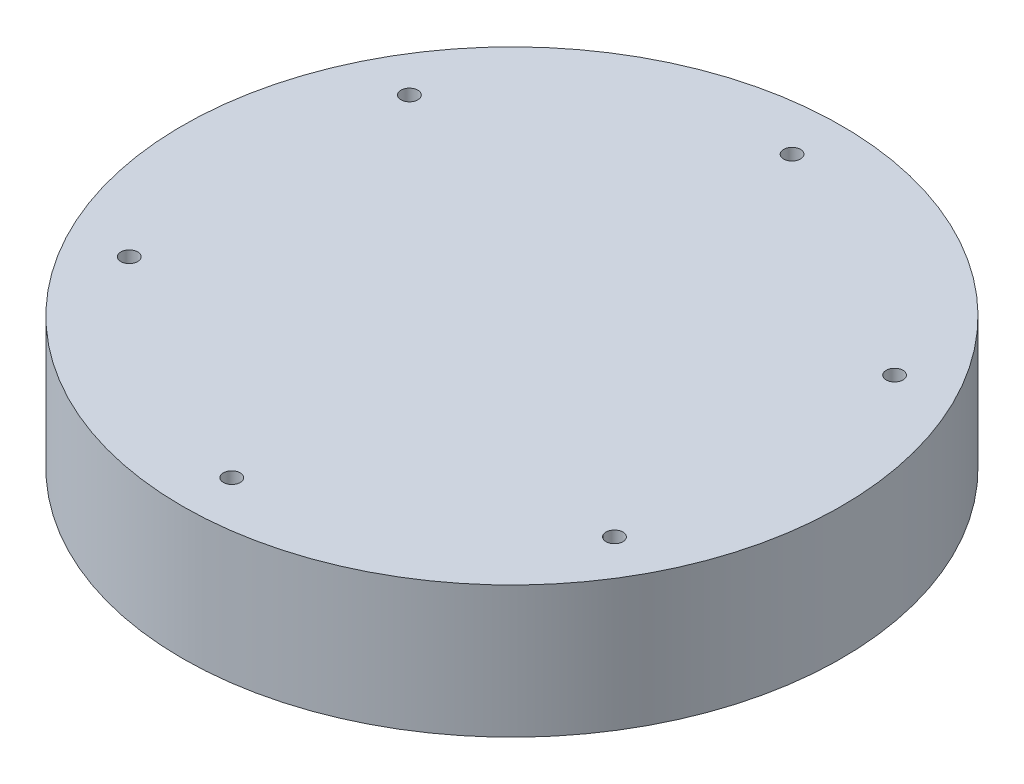
from build123d import *

# Parameters (mm, degrees)
SKETCH1_R           = 100
BOSS_EXTRUDE1_DEPTH = 40
CIRPATTERN1_COUNT   = 6


with BuildPart() as part:
    # Sketch1 → Boss-Extrude1 (new body)
    with BuildSketch(Plane(origin=(0, 0, 0), x_dir=(1, 0, 0), z_dir=(0, 1, 0))):
        with Locations(Location((0, 0, 0), (0, 0, 270))):
            Circle(SKETCH1_R)
    extrude(amount=BOSS_EXTRUDE1_DEPTH)

    # Sketch2 → 1/4-20 Tapped Hole1 (revolve, cut)
    with BuildSketch(Plane(origin=(0, 40, -85), x_dir=(0, 0, 1), z_dir=(1, 0, 0))):
        Polygon((0, 0), (0, 18.043816902), (2.5527, 16.51), (2.5527, 0), align=None)
    f_1_4_20_tapped_hole1 = revolve(axis=Axis((0, 46.35, -85), (0, -1, 0)), mode=Mode.SUBTRACT)

    # CirPattern1: 1/4-20 Tapped Hole1 ×6 about axis
    cirpattern1_axis = Axis((0, 0, 0), (0, 1, 0))
    for i in range(1, CIRPATTERN1_COUNT):
        add(f_1_4_20_tapped_hole1.rotate(cirpattern1_axis, i * 360 / CIRPATTERN1_COUNT), mode=Mode.SUBTRACT)


solid = part.part
